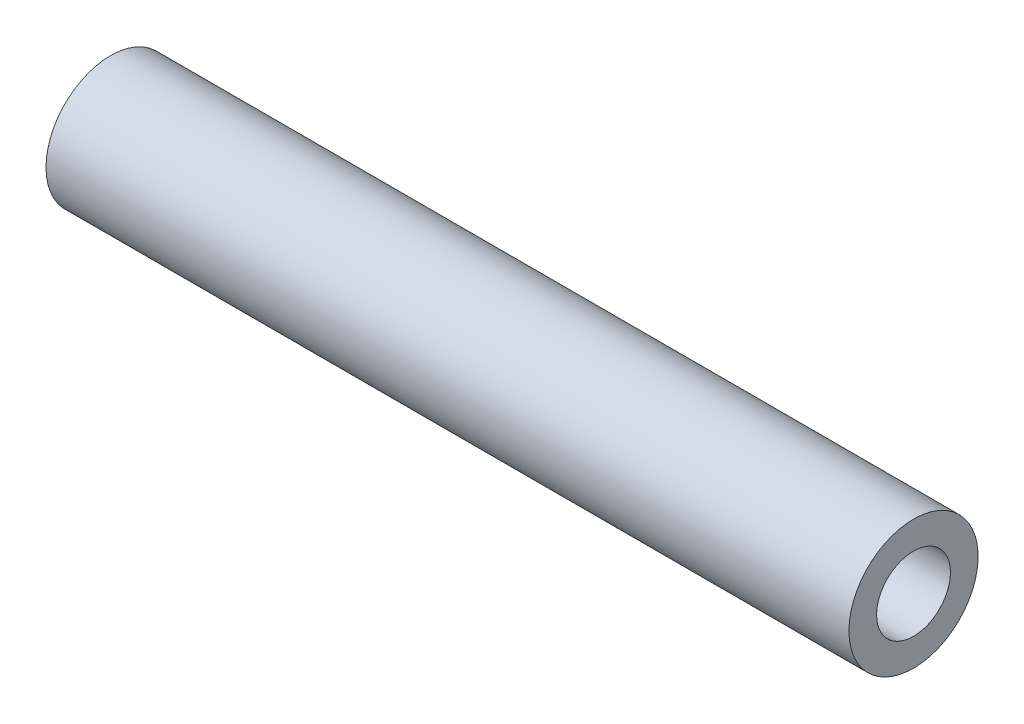
from build123d import *

# Parameters (mm, degrees)
SKETCH_1_W = 87
SKETCH_1_H = 3


with BuildPart() as part:
    # ｽｹｯﾁ1 → 回転1 (revolve)
    with BuildSketch(Plane.XY, mode=Mode.PRIVATE) as revolve_1_sk:
        with Locations((0, 5.5)):
            Rectangle(SKETCH_1_W, SKETCH_1_H)
    revolve(revolve_1_sk.sketch.rotate(Axis((0, 0, 0), (1, 0, 0)), 90), axis=Axis((0, 0, 0), (1, 0, 0)))


solid = part.part
